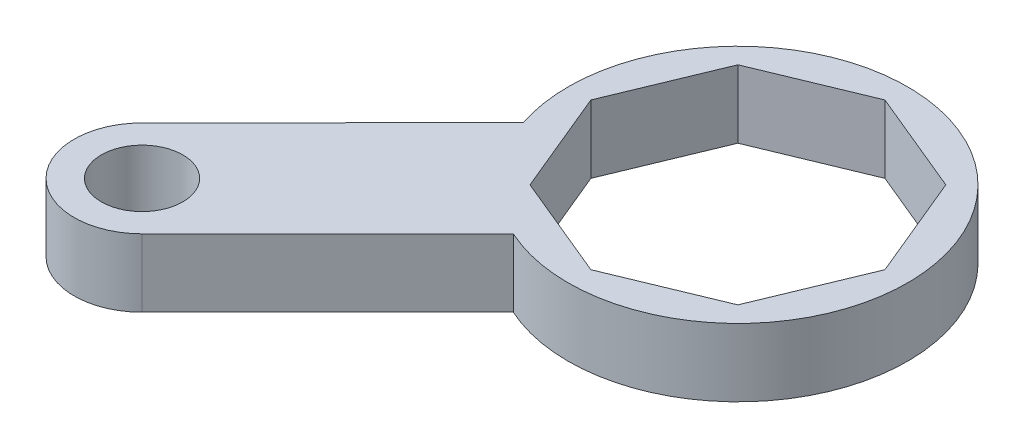
from build123d import *

# Parameters (mm, degrees)
SKETCH1_R           = 3
BOSS_EXTRUDE1_DEPTH = 5


with BuildPart() as part:
    # Sketch1 → Boss-Extrude1 (new body)
    with BuildSketch(Plane(origin=(0, 0, 0), x_dir=(1, 0, 0), z_dir=(0, 1, 0))):
        with BuildLine():
            Line((-25.881865259, -17.986942888), (-11.865528355, -3.931823604))
            ThreePointArc((-11.865528355, -3.931823604), (9.287225619, 8.366447293), (-5.144892732, -11.392105985))
            Line((-5.144892732, -11.392105985), (-18.810797447, -25.0580107))
            ThreePointArc((-18.810797447, -25.0580107), (-25.881865259, -25.0580107), (-25.881865259, -17.986942888))
        make_face()
        with Locations(Location((-22.346331353, -21.522476794, 0), (0, 0, 270))):
            Circle(SKETCH1_R, mode=Mode.SUBTRACT)
        Polygon((0, 10.823922003), (-7.653668647, 7.653668647), (-10.823922003, 0), (-7.653668647, -7.653668647), (0, -10.823922003), (7.653668647, -7.653668647), (10.823922003, 0), (7.653668647, 7.653668647), align=None, mode=Mode.SUBTRACT)
    extrude(amount=BOSS_EXTRUDE1_DEPTH)


solid = part.part
